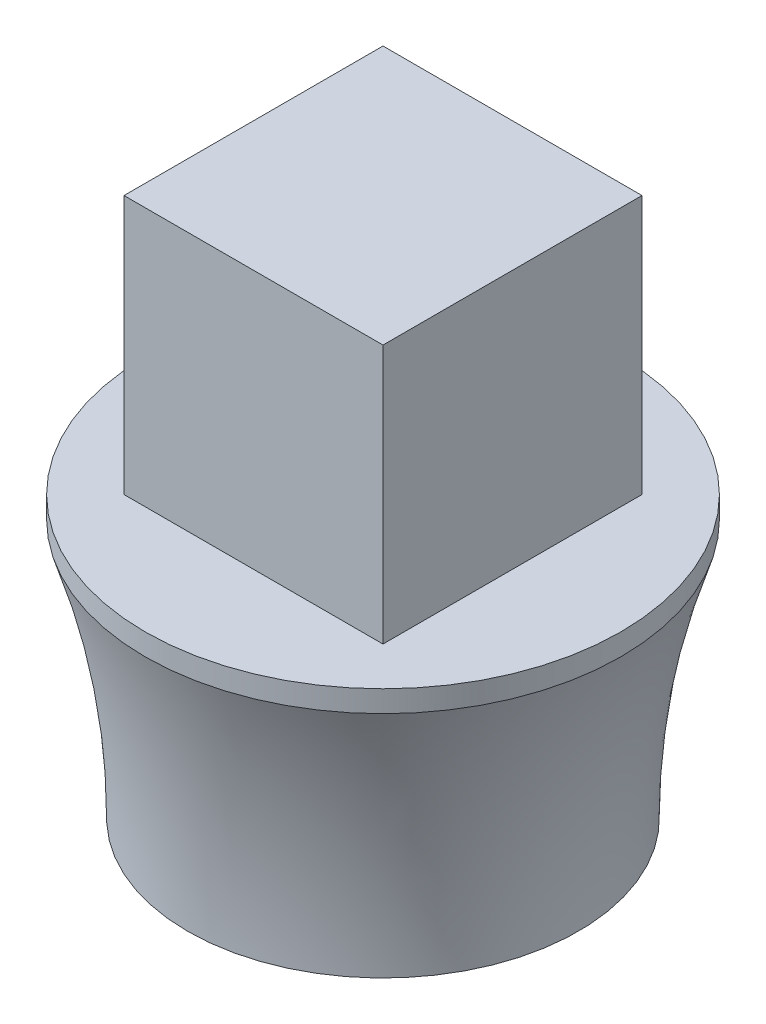
from build123d import *

# Parameters (mm, degrees)
BOSS_EXTRUDE1_START = 6.35
SKETCH2_R           = 70
SKETCH2_R_2         = 55
BOSS_EXTRUDE1_DEPTH = 6.35
SKETCH5_W           = 76.2
SKETCH5_H           = 76.2
BOSS_EXTRUDE3_DEPTH = 76.2


with BuildPart() as part:
    # Sketch1 → Revolve1 (revolve)
    with BuildSketch(Plane.XY, mode=Mode.PRIVATE) as revolve1_sk:
        with BuildLine():
            Line((55, 0), (55, 76.2))
            Line((55, 76.2), (70, 76.2))
            ThreePointArc((70, 76.2), (60.645745066, 38.609228172), (57.5, 0))
            Line((57.5, 0), (55, 0))
        make_face()
    revolve(revolve1_sk.sketch.rotate(Axis((0, 0, 0), (0, 1, 0)), 90), axis=Axis((0, 0, 0), (0, 1, 0)))

    # Sketch2 → Boss-Extrude1 (add)
    # profile 1 of 2: a face of its own
    with BuildSketch(Plane(origin=(0, 76.2, 0), x_dir=(1, 0, 0), z_dir=(0, 1, 0)).offset(BOSS_EXTRUDE1_START)):
        with Locations(Location((0, 0, 0), (0, 0, 270))):
            Circle(SKETCH2_R)
        with Locations(Location((0, 0, 0), (0, 0, 90))):
            Circle(SKETCH2_R_2, mode=Mode.SUBTRACT)
    # profile 2 of 2: a face of its own
    with BuildSketch(Plane(origin=(0, 76.2, 0), x_dir=(1, 0, 0), z_dir=(0, 1, 0)).offset(BOSS_EXTRUDE1_START)):
        with Locations(Location((0, 0, 0), (0, 0, 90))):
            Circle(SKETCH2_R_2)
    extrude(amount=-BOSS_EXTRUDE1_DEPTH)

    # Sketch5 → Boss-Extrude3 (add)
    with BuildSketch(Plane(origin=(0, 82.55, 0), x_dir=(1, 0, 0), z_dir=(0, 1, 0))):
        Rectangle(SKETCH5_W, SKETCH5_H)
    extrude(amount=BOSS_EXTRUDE3_DEPTH)


solid = part.part
